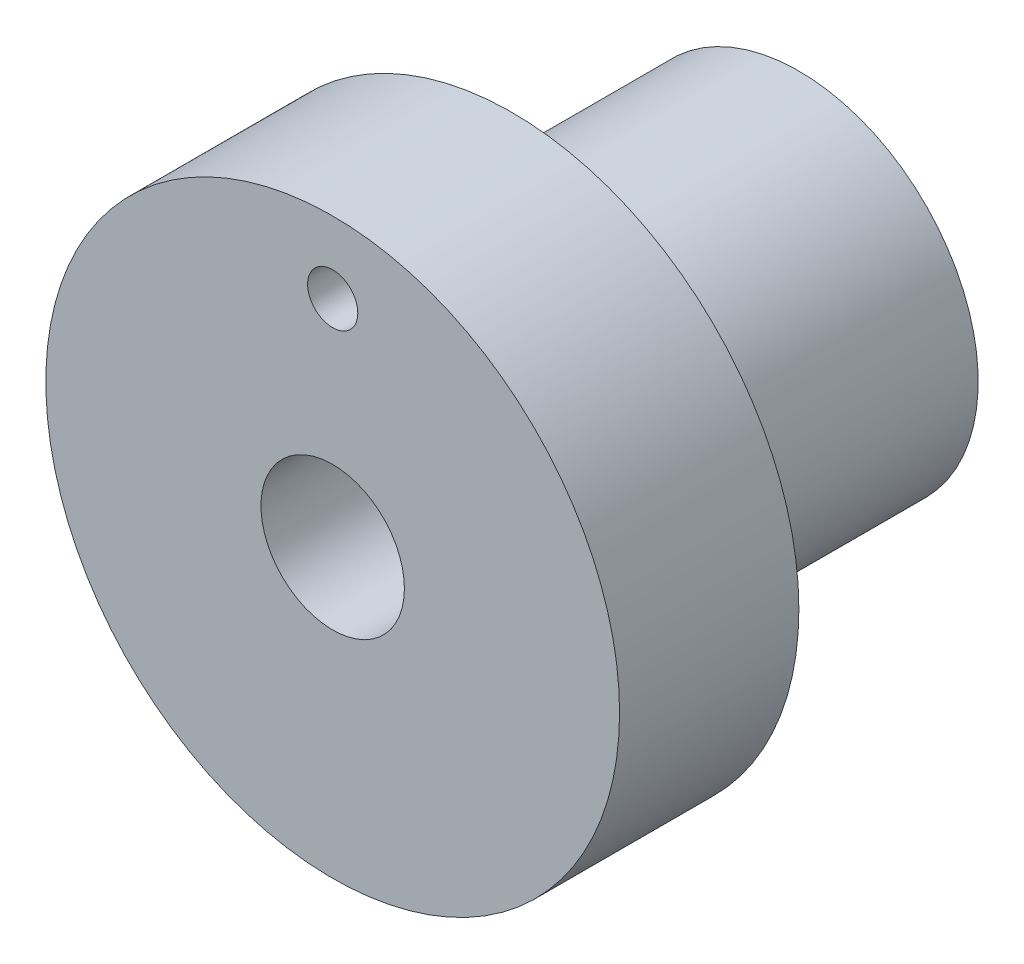
from build123d import *

# Parameters (mm, degrees)
SKETCH2_R           = 40
BOSS_EXTRUDE1_DEPTH = 25
SKETCH3_R           = 25
BOSS_EXTRUDE2_DEPTH = 40
SKETCH4_R           = 10
CUT_EXTRUDE1_DEPTH  = 87.168439698
SKETCH5_R           = 3.5
CUT_EXTRUDE2_DEPTH  = 87.168439698


with BuildPart() as part:
    # Sketch2 → Boss-Extrude1 (new body)
    with BuildSketch(Plane.XY):
        Circle(SKETCH2_R)
    extrude(amount=-BOSS_EXTRUDE1_DEPTH)

    # Sketch3 → Boss-Extrude2 (add)
    with BuildSketch(Plane(origin=(0, 0, -25), x_dir=(-1, 0, 0), z_dir=(0, 0, -1))):
        Circle(SKETCH3_R)
    extrude(amount=BOSS_EXTRUDE2_DEPTH)

    # Sketch4 → Cut-Extrude1 (cut, through all)
    with BuildSketch(Plane.XY):
        Circle(SKETCH4_R)
    extrude(amount=-CUT_EXTRUDE1_DEPTH, mode=Mode.SUBTRACT)

    # Sketch5 → Cut-Extrude2 (cut, through all)
    with BuildSketch(Plane.XY):
        with Locations((0, 30)):
            Circle(SKETCH5_R)
    extrude(amount=-CUT_EXTRUDE2_DEPTH, mode=Mode.SUBTRACT)


solid = part.part
